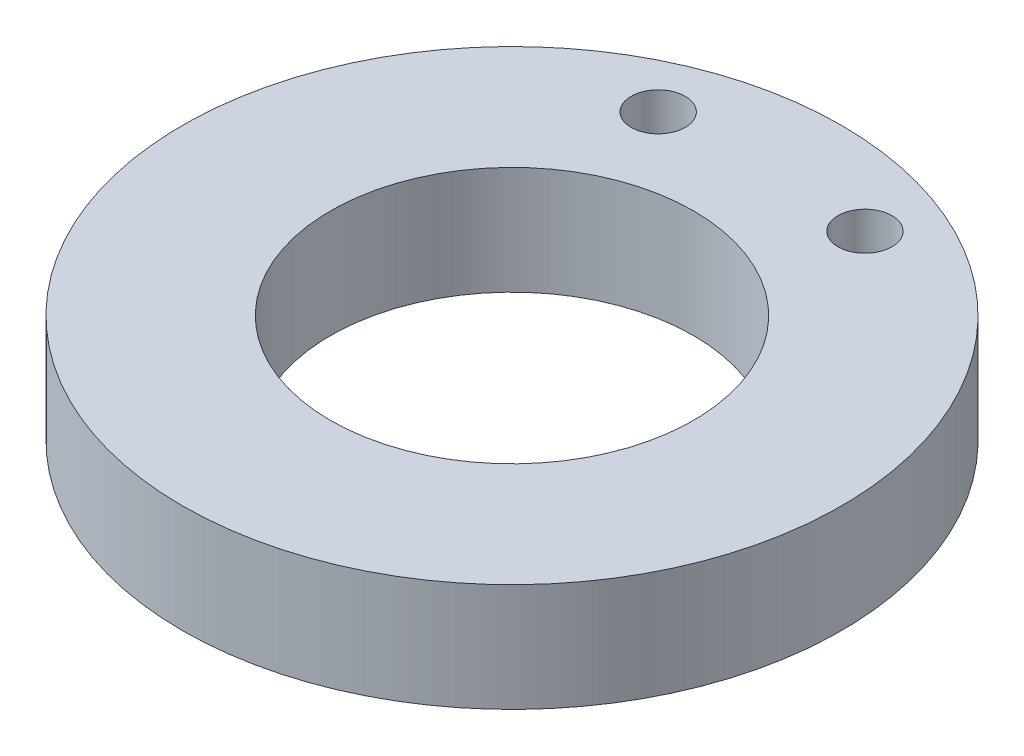
from build123d import *

# Parameters (mm, degrees)
SKETCH1_R           = 30.5
SKETCH1_R_2         = 16.8
SKETCH1_R_3         = 2.5
BOSS_EXTRUDE1_DEPTH = 10


with BuildPart() as part:
    # Sketch1 → Boss-Extrude1 (new body)
    with BuildSketch(Plane(origin=(0, 0, 0), x_dir=(1, 0, 0), z_dir=(0, 1, 0))):
        with Locations(Location((0, 0, 0), (0, 0, 270))):
            Circle(SKETCH1_R)
        with Locations(Location((0, 0, 0), (0, 0, 270))):
            Circle(SKETCH1_R_2, mode=Mode.SUBTRACT)
        with Locations(Location((9.567085809, 23.096988313, 0), (0, 0, 270))):
            Circle(SKETCH1_R_3, mode=Mode.SUBTRACT)
        with Locations(Location((-9.567085809, 23.096988313, 0), (0, 0, 90))):
            Circle(SKETCH1_R_3, mode=Mode.SUBTRACT)
    extrude(amount=BOSS_EXTRUDE1_DEPTH)


solid = part.part
